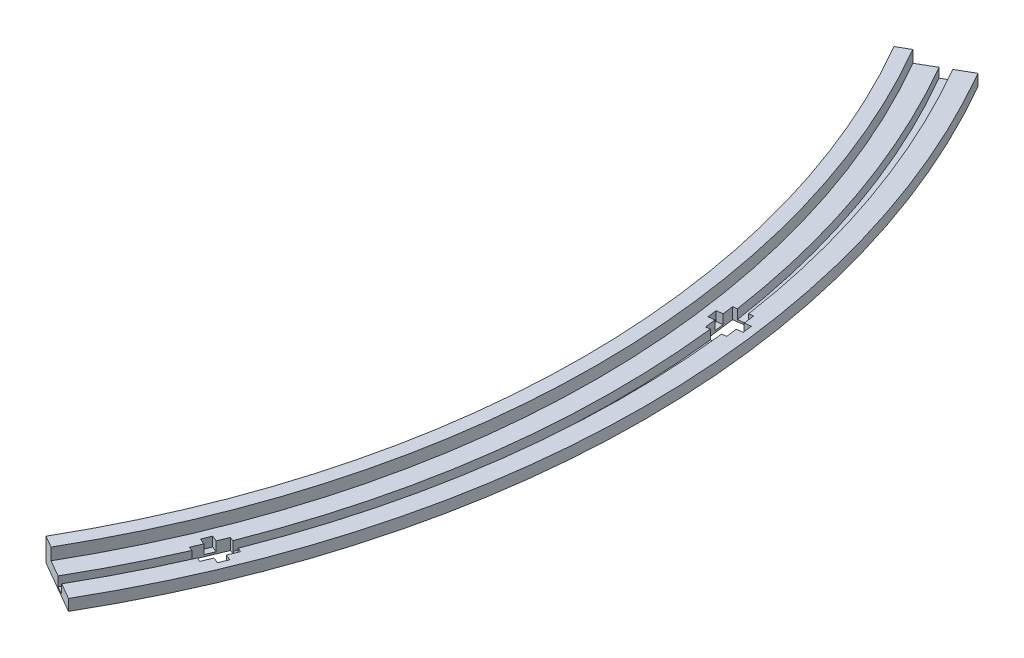
from build123d import *

# Parameters (mm, degrees)
AUFSATZ_LINEAR_AUSTRAGEN1_DEPTH = 3.6
SCHNITT_LINEAR_AUSTRAGEN1_DEPTH = 3
SCHNITT_LINEAR_AUSTRAGEN2_DEPTH = 325.249841943
SCHNITT_LINEAR_AUSTRAGEN3_DEPTH = 3
AUFSATZ_LINEAR_AUSTRAGEN2_DEPTH = 3.8


with BuildPart() as part:
    # Skizze1 → Aufsatz-Linear austragen1 (new body)
    with BuildSketch(Plane(origin=(0, 0, 0), x_dir=(1, 0, 0), z_dir=(0, 1, 0))):
        with BuildLine():
            Line((251.147367097, 145), (234.173269183, 135.2))
            ThreePointArc((234.173269183, 135.2), (270.4, 0), (234.173269183, -135.2))
            Line((234.173269183, -135.2), (251.147367097, -145))
            ThreePointArc((251.147367097, -145), (290, 0), (251.147367097, 145))
        make_face()
    extrude(amount=AUFSATZ_LINEAR_AUSTRAGEN1_DEPTH)

    # Skizze2 → Schnitt-Linear austragen1 (cut)
    with BuildSketch(Plane(origin=(0, 3.6, 0), x_dir=(1, 0, 0), z_dir=(0, 1, 0))):
        with BuildLine():
            Line((243.266535923, 140.45), (246.037817215, 142.05))
            ThreePointArc((246.037817215, 142.05), (284.1, 0), (246.037817215, -142.05))
            Line((246.037817215, -142.05), (243.266535923, -140.45))
            ThreePointArc((243.266535923, -140.45), (280.9, 0), (243.266535923, 140.45))
        make_face()
    extrude(amount=-SCHNITT_LINEAR_AUSTRAGEN1_DEPTH, mode=Mode.SUBTRACT)

    # Skizze3 → Schnitt-Linear austragen2 (cut, through all)
    with BuildSketch(Plane(origin=(0, 3.6, 0), x_dir=(1, 0, 0), z_dir=(0, 1, 0))):
        Polygon((276.456207793, 41.439295032), (282.404876961, 42.222452186), (283.710138883, 32.308003572), (277.761469715, 31.524846419), align=None)
        Polygon((256.310912175, -111.579417009), (261.85418937, -113.875517603), (265.681023694, -104.636722278), (260.137746499, -102.340621683), align=None)
    extrude(amount=-SCHNITT_LINEAR_AUSTRAGEN2_DEPTH, mode=Mode.SUBTRACT)

    # Skizze4 → Schnitt-Linear austragen3 (cut)
    with BuildSketch(Plane(origin=(0, 3.6, 0), x_dir=(1, 0, 0), z_dir=(0, 1, 0))):
        Polygon((256.95059542, -104.808833183), (266.189390746, -108.635667506), (265.041340448, -111.407306104), (255.802545123, -107.58047178), align=None)
        Polygon((274.930159743, 37.708185633), (284.844608357, 39.013447555), (285.236186933, 36.039112971), (275.32173832, 34.733851049), align=None)
    extrude(amount=-SCHNITT_LINEAR_AUSTRAGEN3_DEPTH, mode=Mode.SUBTRACT)

    # Skizze5 → Aufsatz-Linear austragen2 (add)
    with BuildSketch(Plane(origin=(0, 3.6, 0), x_dir=(1, 0, 0), z_dir=(0, 1, 0))):
        with BuildLine():
            Line((234.173269183, 135.2), (237.98378096, 137.4))
            ThreePointArc((237.98378096, 137.4), (274.8, 0), (237.98378096, -137.4))
            Line((237.98378096, -137.4), (234.173269183, -135.2))
            ThreePointArc((234.173269183, -135.2), (270.4, 0), (234.173269183, 135.2))
        make_face()
    extrude(amount=AUFSATZ_LINEAR_AUSTRAGEN2_DEPTH)


solid = part.part
